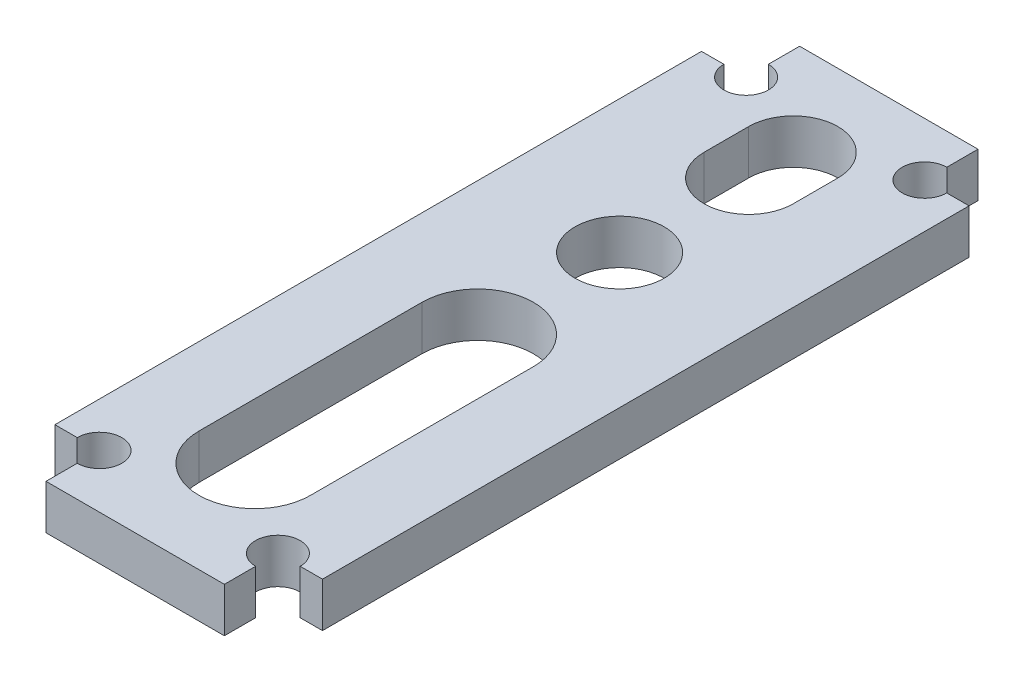
from build123d import *

# Parameters (mm, degrees)
SKETCH_1_R      = 1
EXTRUDE_1_DEPTH = 1


with BuildPart() as part:
    # 草图1 → 凸台-拉伸1 (new body)
    with BuildSketch(Plane(origin=(0, 0, 0), x_dir=(1, 0, 0), z_dir=(0, 1, 0))):
        with BuildLine():
            Line((-2, 16.38774479), (-2, 15.88774479))
            ThreePointArc((-2, 15.88774479), (-1.646446609, 15.034191399), (-2.5, 15.38774479))
            Line((-2.5, 15.38774479), (-3, 15.38774479))
            Line((-3, 15.38774479), (-3, 14.38774479))
            Line((-3, 14.38774479), (-3, 3.38774479))
            Line((-3, 3.38774479), (-3, 2.087766192))
            Line((-3, 2.087766192), (-3, 0.887766192))
            Line((-3, 0.887766192), (-2.5, 0.887766192))
            ThreePointArc((-2.5, 0.887766192), (-1.646446609, 1.241319582), (-2, 0.387766192))
            Line((-2, 0.387766192), (-2, -0.312233808))
            Line((-2, -0.312233808), (2, -0.312233808))
            Line((2, -0.312233808), (2, 0.387766192))
            ThreePointArc((2, 0.387766192), (1.646446609, 1.241319582), (2.5, 0.887766192))
            Line((2.5, 0.887766192), (3, 0.887766192))
            Line((3, 0.887766192), (3, 2.087766192))
            Line((3, 2.087766192), (3, 3.38774479))
            Line((3, 3.38774479), (3, 14.38774479))
            Line((3, 14.38774479), (3, 15.38774479))
            Line((3, 15.38774479), (2.5, 15.38774479))
            ThreePointArc((2.5, 15.38774479), (1.646446609, 15.034191399), (2, 15.88774479))
            Line((2, 15.88774479), (2, 16.58774479))
            Line((2, 16.58774479), (-2, 16.58774479))
            Line((-2, 16.58774479), (-2, 16.38774479))
        make_face()
        with BuildLine():
            ThreePointArc((1.238170819, 2.380547047), (-0.011829181, 1.130547047), (-1.261829181, 2.380547047))
            Line((-1.261829181, 2.380547047), (-1.261829181, 7.380547047))
            ThreePointArc((-1.261829181, 7.380547047), (-0.011829181, 8.630547047), (1.238170819, 7.380547047))
            Line((1.238170819, 7.380547047), (1.238170819, 2.380547047))
        make_face(mode=Mode.SUBTRACT)
        with Locations(Location((-0.011829181, 10.562782389, 0), (0, 0, 270))):
            Circle(SKETCH_1_R, mode=Mode.SUBTRACT)
        with BuildLine():
            ThreePointArc((0.988170819, 13.456705927), (-0.011829181, 12.456705927), (-1.011829181, 13.456705927))
            Line((-1.011829181, 13.456705927), (-1.011829181, 14.456705927))
            ThreePointArc((-1.011829181, 14.456705927), (-0.011829181, 15.456705927), (0.988170819, 14.456705927))
            Line((0.988170819, 14.456705927), (0.988170819, 13.456705927))
        make_face(mode=Mode.SUBTRACT)
    extrude(amount=EXTRUDE_1_DEPTH)


solid = part.part
